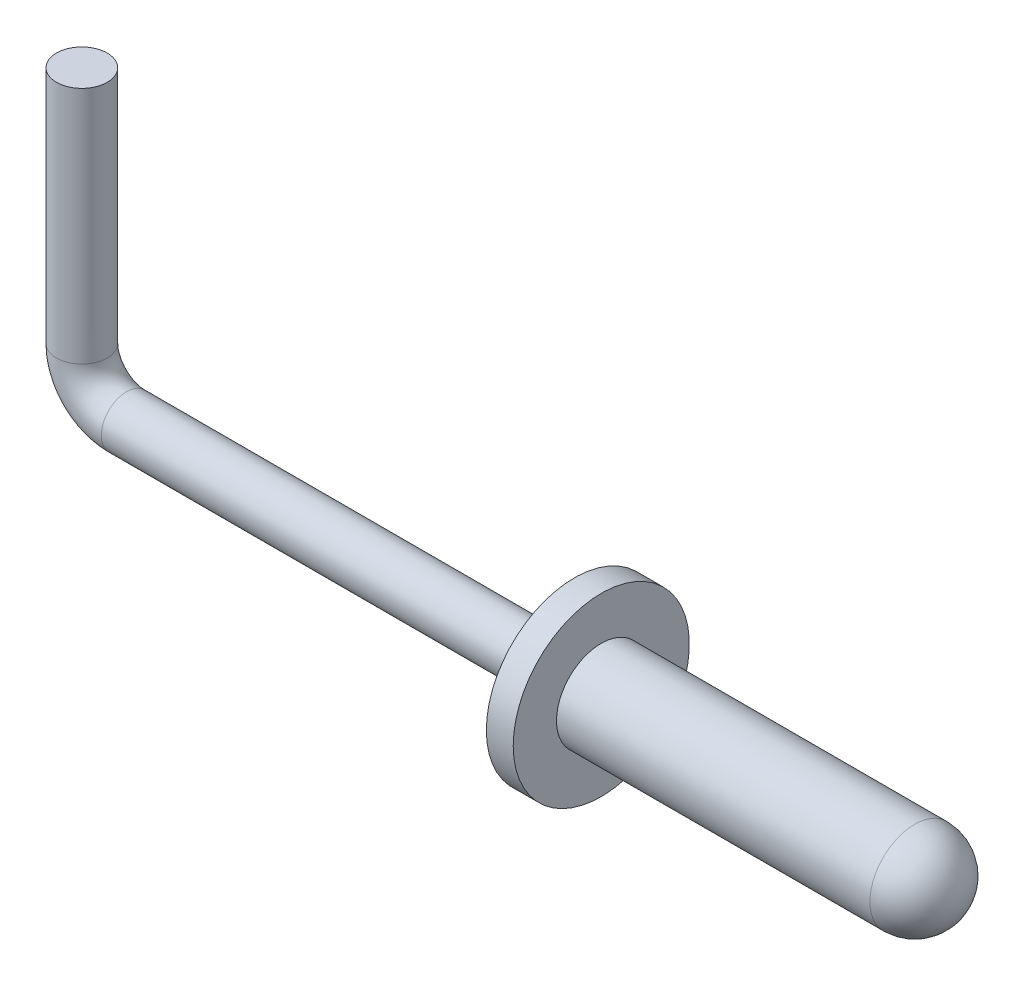
from build123d import *

# Parameters (mm, degrees)
SKETCH1_R           = 1.5
BOSS_EXTRUDE1_DEPTH = 10.5
SKETCH2_R           = 2.95
BOSS_EXTRUDE2_DEPTH = 0.9
SWEEP1_PROFILE_R    = 0.85


with BuildPart() as part:
    # Sketch1 → Boss-Extrude1 (new body)
    with BuildSketch(Plane(origin=(0, 0, 0), x_dir=(0, 0, -1), z_dir=(1, 0, 0))):
        with Locations(Location((0, 0, 0), (0, 0, 180))):
            Circle(SKETCH1_R)
    extrude(amount=BOSS_EXTRUDE1_DEPTH)

    # Sketch8 → Revolve1 (revolve)
    with BuildSketch(Plane(origin=(10.5, 0, 0), x_dir=(0, 0, -1), z_dir=(1, 0, 0))):
        with BuildLine():
            Line((1.5, 0), (-1.5, 0))
            ThreePointArc((-1.5, 0), (0, 1.5), (1.5, 0))
        make_face()
    revolve(axis=Axis((10.5, 0, -1.5), (0, 0, 1)))

    # Sketch2 → Boss-Extrude2 (add)
    with BuildSketch(Plane.ZY):
        Circle(SKETCH2_R)
    extrude(amount=BOSS_EXTRUDE2_DEPTH)

    # Sweep1: sweep along a path in Sketch3
    with BuildLine(Plane.XY) as sweep1_path:
        Line((-0.9, 0), (-15.9, 0))
        ThreePointArc((-15.9, 0), (-16.960660172, 0.439339828), (-17.4, 1.5))
        Line((-17.4, 1.5), (-17.4, 9.5))
    # Sweep1 profile (on start of the path) → Sweep1 (sweep)
    with BuildSketch(Plane(origin=(-0.9, 0, 0), x_dir=(0, -1, 0), z_dir=(-1, 0, 0))):
        Circle(SWEEP1_PROFILE_R)
    sweep(path=sweep1_path.line)


solid = part.part
